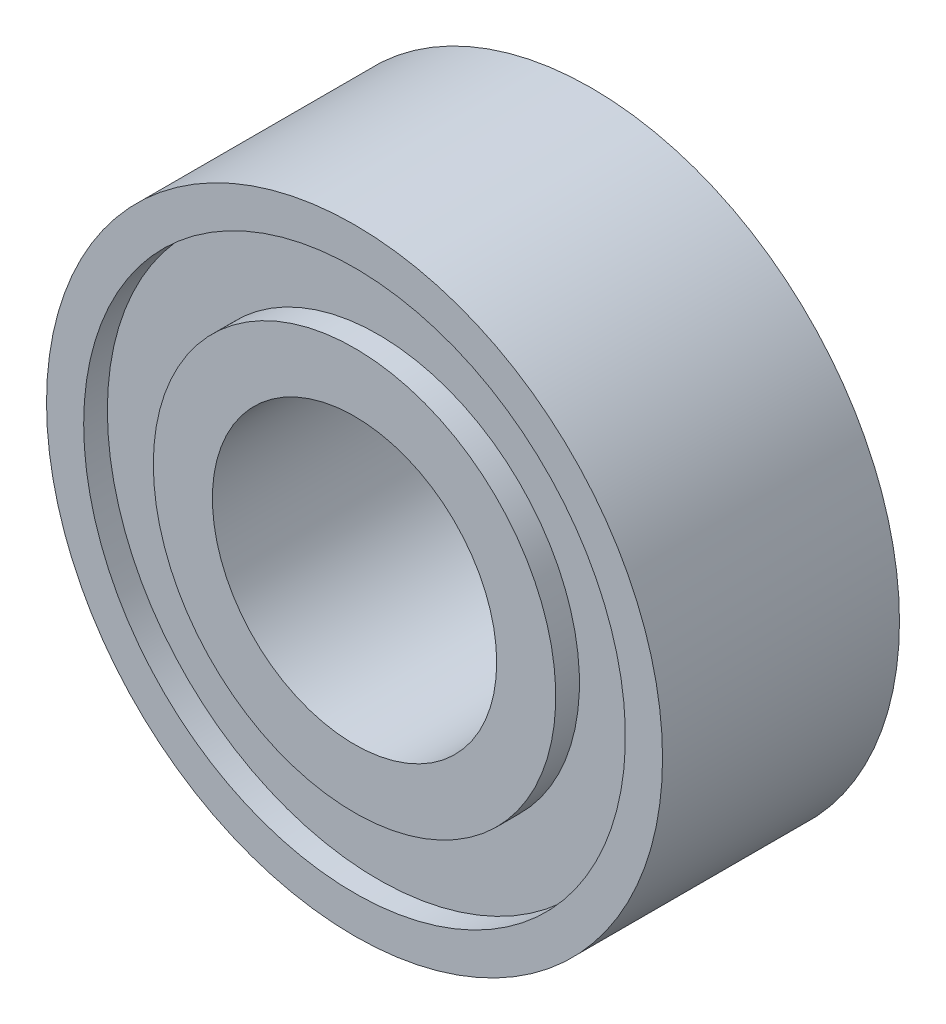
from build123d import *

# Parameters (mm, degrees)
SKETCH_1_R          = 6.5
SKETCH_1_R_2        = 3
EXTRUDE_1_DEPTH     = 2.5
SKETCH_2_R          = 5.716050362
SKETCH_2_R_2        = 4.24621305
CUT_EXTRUDE_1_DEPTH = 0.5


with BuildPart() as part:
    # 草图1 → 凸台-拉伸1 (new, symmetric)
    with BuildSketch(Plane.XY):
        Circle(SKETCH_1_R)
        Circle(SKETCH_1_R_2, mode=Mode.SUBTRACT)
    extrude(amount=EXTRUDE_1_DEPTH, both=True)

    # 草图2 → 切除-拉伸1 (cut)
    with BuildSketch(Plane(origin=(0, 0, -2.5), x_dir=(-1, 0, 0), z_dir=(0, 0, -1))):
        Circle(SKETCH_2_R)
        Circle(SKETCH_2_R_2, mode=Mode.SUBTRACT)
    cut_extrude_1 = extrude(amount=-CUT_EXTRUDE_1_DEPTH, mode=Mode.SUBTRACT)

    # 镜向1: 切除-拉伸1 across plane
    add(cut_extrude_1.mirror(Plane.XY), mode=Mode.SUBTRACT)


solid = part.part
